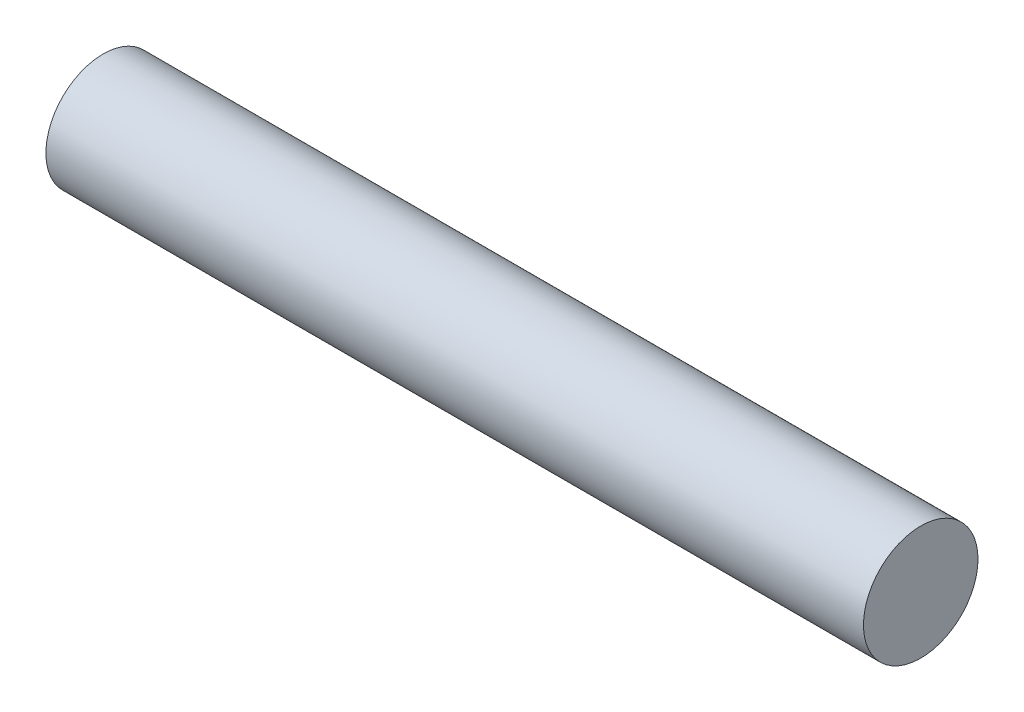
from build123d import *

# Parameters (mm, degrees)
BOSS_EXTRUDE1_DEPTH      = 159.131
BOSS_EXTRUDE1_DEPTH_BACK = 159.131
SKETCH1_R                = 22.292818


with BuildPart() as part:
    # Sketch1 → Boss-Extrude1 (new, two sides: drawn at the far end of the back side and taken through both)
    with BuildSketch(Plane(origin=(0, 0, 0), x_dir=(0, 0, -1), z_dir=(1, 0, 0)).offset(-BOSS_EXTRUDE1_DEPTH_BACK)):
        Circle(SKETCH1_R)
    extrude(amount=BOSS_EXTRUDE1_DEPTH + BOSS_EXTRUDE1_DEPTH_BACK)


solid = part.part
